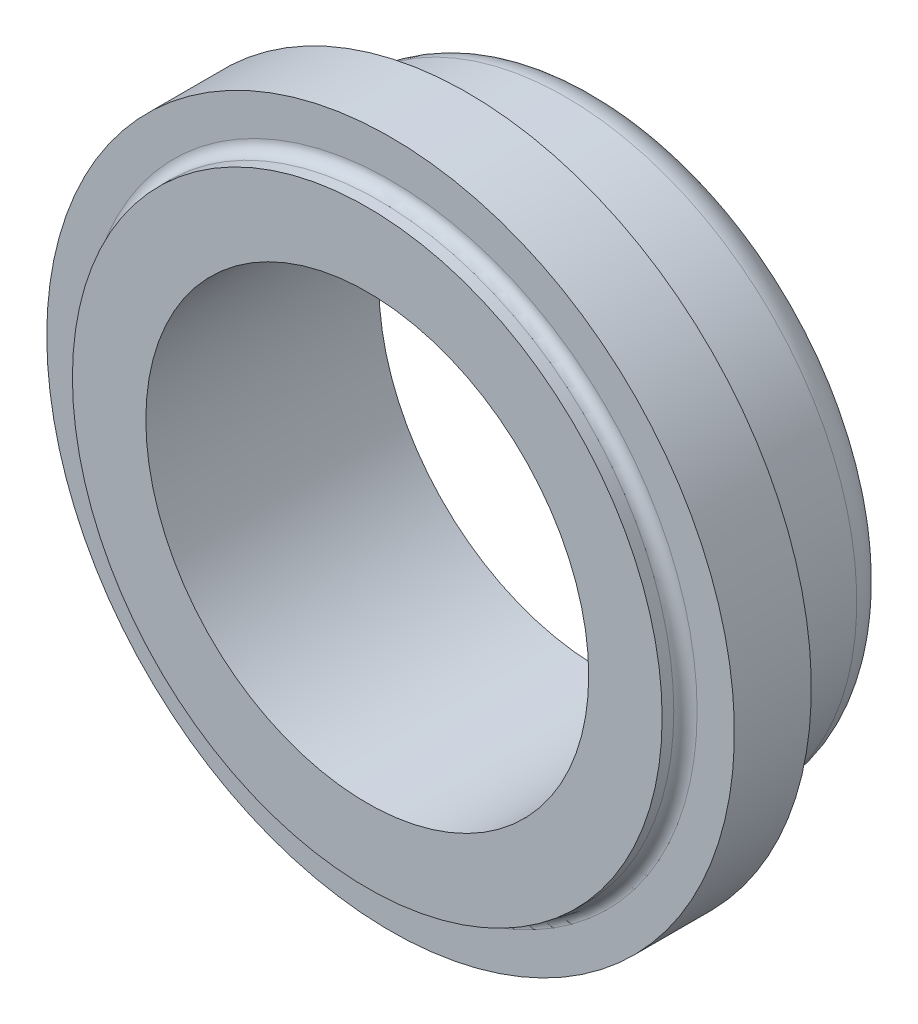
from build123d import *

# Parameters (mm, degrees)
FILLET1_R                                  = 3
FILLET2_R                                  = 1
CBORE_FOR_M2_5_SHCS1_D                     = 2.9
CBORE_FOR_M2_5_SHCS1_DEPTH                 = 8
CBORE_FOR_M2_5_SHCS1_CBORE_D               = 5.5
CBORE_FOR_M2_5_SHCS1_CBORE_DEPTH           = 4.5
CBORE_FOR_M2_5_SHCS1_TIP                   = 0.871247898
CBORE_FOR_M2_5_SHCS1_ON_FACE_2_D           = 2.9
CBORE_FOR_M2_5_SHCS1_ON_FACE_2_DEPTH       = 8
CBORE_FOR_M2_5_SHCS1_ON_FACE_2_CBORE_D     = 5.5
CBORE_FOR_M2_5_SHCS1_ON_FACE_2_CBORE_DEPTH = 4.5
CBORE_FOR_M2_5_SHCS1_ON_FACE_2_TIP         = 0.871247898


with BuildPart() as part:
    # Sketch2 → Revolve1 (revolve)
    with BuildSketch(Plane(origin=(0, 0, 0), x_dir=(1, 0, 0), z_dir=(0, 1, 0))):
        Polygon((-23, 2), (-23, 3.5), (-25, 5.5), (-25, 18), (-19, 18), (-19, -2), (-25.3, -2), (-25.3, 0), (-29.5, 0), (-29.5, 6.6), (-27.5, 6.6), (-27.5, 2), align=None)
    revolve(axis=Axis((0, 0, -30.363549001), (0, 0, 1)))

    # Fillet1
    fillet1_edges = [part.edges().sort_by_distance(p)[0] for p in [
        (25, 0, -18),
    ]]
    fillet(fillet1_edges, radius=FILLET1_R)

    # Fillet2
    fillet2_edges = [part.edges().sort_by_distance(p)[0] for p in [
        (25.3, 0, 0),
    ]]
    fillet(fillet2_edges, radius=FILLET2_R)

    # CBORE for M2.5 SHCS1
    with Locations(Plane(origin=(-19.915129246, 15.112499036, -12), x_dir=(-0.604499961451, -0.796605169834, 0), z_dir=(-0.796605169834, 0.604499961451, 0))):
        with Locations((0, 0)):
            CounterBoreHole(CBORE_FOR_M2_5_SHCS1_D / 2, CBORE_FOR_M2_5_SHCS1_CBORE_D / 2, CBORE_FOR_M2_5_SHCS1_CBORE_DEPTH, depth=CBORE_FOR_M2_5_SHCS1_DEPTH)
            with Locations((0, 0, -(CBORE_FOR_M2_5_SHCS1_DEPTH + CBORE_FOR_M2_5_SHCS1_TIP / 2))):  # 118° drill point
                Cone(0, CBORE_FOR_M2_5_SHCS1_D / 2, CBORE_FOR_M2_5_SHCS1_TIP, mode=Mode.SUBTRACT)

    # CBORE for M2.5 SHCS1 on face 2
    with Locations(Plane(origin=(19.915129246, -15.112499036, -12), x_dir=(0.604500067696, 0.79660508921, 0), z_dir=(0.79660508921, -0.604500067696, 0))):
        with Locations((0, 0)):
            CounterBoreHole(CBORE_FOR_M2_5_SHCS1_ON_FACE_2_D / 2, CBORE_FOR_M2_5_SHCS1_ON_FACE_2_CBORE_D / 2, CBORE_FOR_M2_5_SHCS1_ON_FACE_2_CBORE_DEPTH, depth=CBORE_FOR_M2_5_SHCS1_ON_FACE_2_DEPTH)
            with Locations((0, 0, -(CBORE_FOR_M2_5_SHCS1_ON_FACE_2_DEPTH + CBORE_FOR_M2_5_SHCS1_ON_FACE_2_TIP / 2))):  # 118° drill point
                Cone(0, CBORE_FOR_M2_5_SHCS1_ON_FACE_2_D / 2, CBORE_FOR_M2_5_SHCS1_ON_FACE_2_TIP, mode=Mode.SUBTRACT)


solid = part.part
